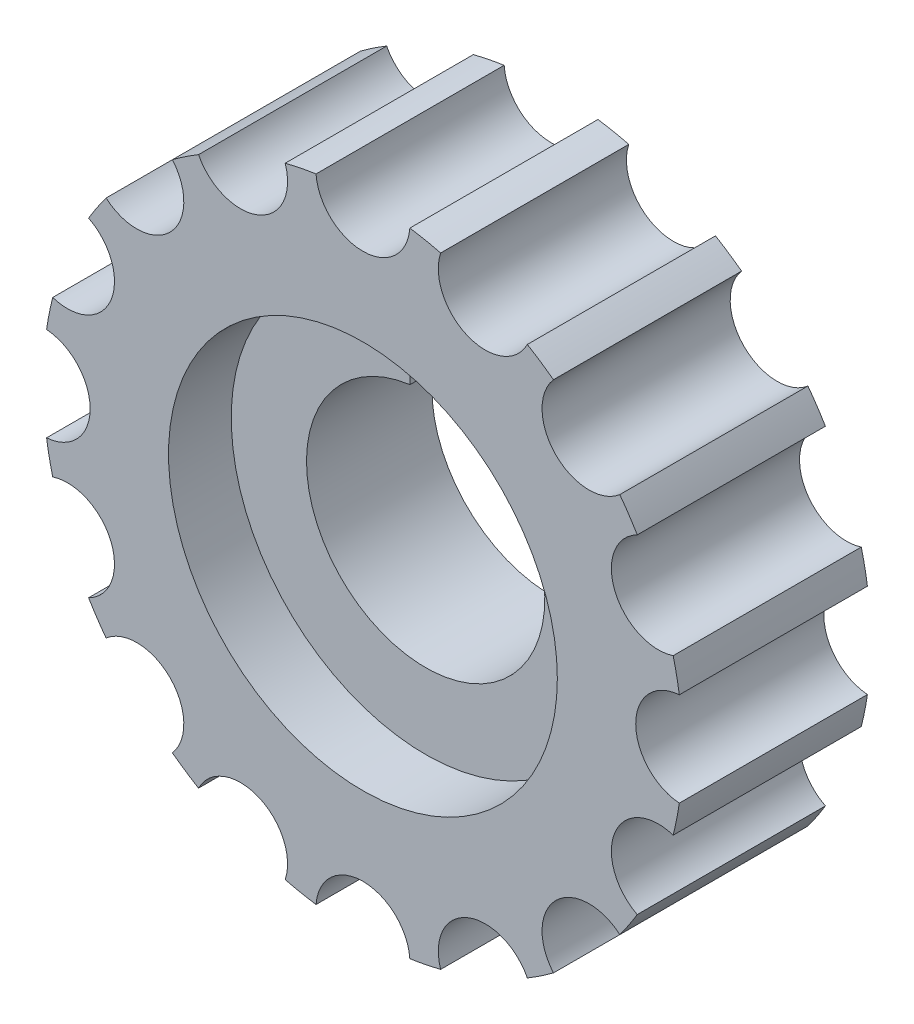
from build123d import *

# Parameters (mm, degrees)
SKETCH1_R           = 31
BOSS_EXTRUDE1_DEPTH = 30
SKETCH1_3_R         = 31
SKETCH1_3_R_2       = 19
BOSS_EXTRUDE2_DEPTH = 20
SKETCH3_W           = 5
SKETCH3_H           = 12
CUT_EXTRUDE7_DEPTH  = 20


with BuildPart() as part:
    # Sketch1 → Boss-Extrude1 (new body)
    with BuildSketch(Plane.XY):
        with BuildLine():
            ThreePointArc((50.448529412, -7.479697868), (43.5, 0), (50.448529412, 7.479697868))
            ThreePointArc((50.448529412, 7.479697868), (50.020049301, 9.949606423), (49.470720222, 12.395476624))
            ThreePointArc((49.470720222, 12.395476624), (40.188759664, 16.646729308), (43.746007316, 26.216156162))
            ThreePointArc((43.746007316, 26.216156162), (42.404950227, 28.334081884), (40.961442331, 30.383552165))
            ThreePointArc((40.961442331, 30.383552165), (30.759144982, 30.759144982), (30.383552165, 40.961442331))
            ThreePointArc((30.383552165, 40.961442331), (28.334081884, 42.404950227), (26.216156162, 43.746007316))
            ThreePointArc((26.216156162, 43.746007316), (16.646729308, 40.188759664), (12.395476624, 49.470720222))
            ThreePointArc((12.395476624, 49.470720222), (9.949606423, 50.020049301), (7.479697868, 50.448529412))
            ThreePointArc((7.479697868, 50.448529412), (0, 43.5), (-7.479697868, 50.448529412))
            ThreePointArc((-7.479697868, 50.448529412), (-9.949606423, 50.020049301), (-12.395476624, 49.470720222))
            ThreePointArc((-12.395476624, 49.470720222), (-16.646729308, 40.188759664), (-26.216156162, 43.746007316))
            ThreePointArc((-26.216156162, 43.746007316), (-28.334081884, 42.404950227), (-30.383552165, 40.961442331))
            ThreePointArc((-30.383552165, 40.961442331), (-30.759144982, 30.759144982), (-40.961442331, 30.383552165))
            ThreePointArc((-40.961442331, 30.383552165), (-42.404950227, 28.334081884), (-43.746007316, 26.216156162))
            ThreePointArc((-43.746007316, 26.216156162), (-40.188759664, 16.646729308), (-49.470720222, 12.395476624))
            ThreePointArc((-49.470720222, 12.395476624), (-50.020049301, 9.949606423), (-50.448529412, 7.479697868))
            ThreePointArc((-50.448529412, 7.479697868), (-43.5, 0), (-50.448529412, -7.479697868))
            ThreePointArc((-50.448529412, -7.479697868), (-50.020049301, -9.949606423), (-49.470720222, -12.395476624))
            ThreePointArc((-49.470720222, -12.395476624), (-40.188759664, -16.646729308), (-43.746007316, -26.216156162))
            ThreePointArc((-43.746007316, -26.216156162), (-42.404950227, -28.334081884), (-40.961442331, -30.383552165))
            ThreePointArc((-40.961442331, -30.383552165), (-30.759144982, -30.759144982), (-30.383552165, -40.961442331))
            ThreePointArc((-30.383552165, -40.961442331), (-28.334081884, -42.404950227), (-26.216156162, -43.746007316))
            ThreePointArc((-26.216156162, -43.746007316), (-16.646729308, -40.188759664), (-12.395476624, -49.470720222))
            ThreePointArc((-12.395476624, -49.470720222), (-9.949606423, -50.020049301), (-7.479697868, -50.448529412))
            ThreePointArc((-7.479697868, -50.448529412), (0, -43.5), (7.479697868, -50.448529412))
            ThreePointArc((7.479697868, -50.448529412), (9.949606423, -50.020049301), (12.395476624, -49.470720222))
            ThreePointArc((12.395476624, -49.470720222), (16.646729308, -40.188759664), (26.216156162, -43.746007316))
            ThreePointArc((26.216156162, -43.746007316), (28.334081884, -42.404950227), (30.383552165, -40.961442331))
            ThreePointArc((30.383552165, -40.961442331), (30.759144982, -30.759144982), (40.961442331, -30.383552165))
            ThreePointArc((40.961442331, -30.383552165), (42.404950227, -28.334081884), (43.746007316, -26.216156162))
            ThreePointArc((43.746007316, -26.216156162), (40.188759664, -16.646729308), (49.470720222, -12.395476624))
            ThreePointArc((49.470720222, -12.395476624), (50.020049301, -9.949606423), (50.448529412, -7.479697868))
        make_face()
        Circle(SKETCH1_R, mode=Mode.SUBTRACT)
    extrude(amount=BOSS_EXTRUDE1_DEPTH)

    # Sketch1<3> → Boss-Extrude2 (add)
    with BuildSketch(Plane.XY):
        Circle(SKETCH1_3_R)
        Circle(SKETCH1_3_R_2, mode=Mode.SUBTRACT)
    extrude(amount=BOSS_EXTRUDE2_DEPTH)

    # Sketch3 → Cut-Extrude7 (cut)
    with BuildSketch(Plane.XY):
        with Locations((0, 18.767120851)):
            Rectangle(SKETCH3_W, SKETCH3_H)
    extrude(amount=CUT_EXTRUDE7_DEPTH, mode=Mode.SUBTRACT)


solid = part.part
